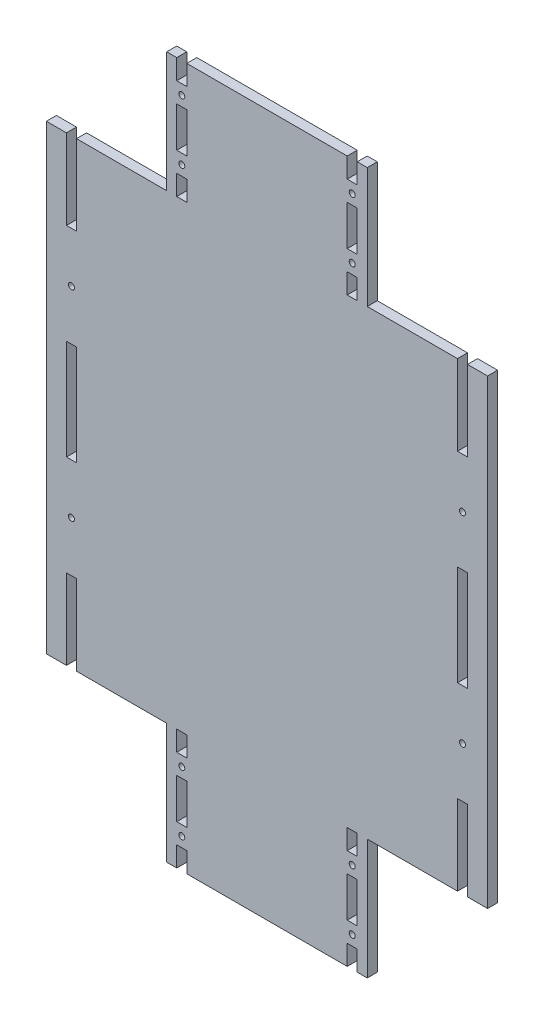
from build123d import *

# Parameters (mm, degrees)
SKETCH1_W           = 220
SKETCH1_H           = 350
BOSS_EXTRUDE1_DEPTH = 5
SKETCH2_W           = 60
SKETCH2_H           = 60
CUT_EXTRUDE2_DEPTH  = 5
SKETCH3_W           = 5
SKETCH3_H           = 10
SKETCH3_H_2         = 20
CUT_EXTRUDE3_DEPTH  = 5
SKETCH4_R           = 1.5
CUT_EXTRUDE4_DEPTH  = 5
SKETCH5_W           = 5
SKETCH5_H           = 40
SKETCH5_H_2         = 50
CUT_EXTRUDE5_DEPTH  = 5
SKETCH6_R           = 1.5
CUT_EXTRUDE6_DEPTH  = 5


with BuildPart() as part:
    # Sketch1 → Boss-Extrude1 (new body)
    with BuildSketch(Plane.XY):
        Rectangle(SKETCH1_W, SKETCH1_H)
    extrude(amount=BOSS_EXTRUDE1_DEPTH)

    # Sketch2 → Cut-Extrude2 (cut)
    with BuildSketch(Plane.XY.offset(5)):
        with Locations((-80, -145)):
            Rectangle(SKETCH2_W, SKETCH2_H)
        with Locations((80, -145)):
            Rectangle(SKETCH2_W, SKETCH2_H)
        with Locations((80, 145)):
            Rectangle(SKETCH2_W, SKETCH2_H)
        with Locations((-80, 145)):
            Rectangle(SKETCH2_W, SKETCH2_H)
    extrude(amount=-CUT_EXTRUDE2_DEPTH, mode=Mode.SUBTRACT)

    # Sketch3 → Cut-Extrude3 (cut)
    with BuildSketch(Plane.XY.offset(5)):
        with Locations((42.5, 170)):
            Rectangle(SKETCH3_W, SKETCH3_H)
        with Locations((42.5, 145)):
            Rectangle(SKETCH3_W, SKETCH3_H_2)
        with Locations((42.5, 120)):
            Rectangle(SKETCH3_W, SKETCH3_H)
        with Locations((-42.5, 170)):
            Rectangle(SKETCH3_W, SKETCH3_H)
        with Locations((-42.5, 145)):
            Rectangle(SKETCH3_W, SKETCH3_H_2)
        with Locations((-42.5, 120)):
            Rectangle(SKETCH3_W, SKETCH3_H)
        with Locations((42.5, -120)):
            Rectangle(SKETCH3_W, SKETCH3_H)
        with Locations((42.5, -145)):
            Rectangle(SKETCH3_W, SKETCH3_H_2)
        with Locations((42.5, -170)):
            Rectangle(SKETCH3_W, SKETCH3_H)
        with Locations((-42.5, -120)):
            Rectangle(SKETCH3_W, SKETCH3_H)
        with Locations((-42.5, -145)):
            Rectangle(SKETCH3_W, SKETCH3_H_2)
        with Locations((-42.5, -170)):
            Rectangle(SKETCH3_W, SKETCH3_H)
    extrude(amount=-CUT_EXTRUDE3_DEPTH, mode=Mode.SUBTRACT)

    # Sketch4 → Cut-Extrude4 (cut)
    with BuildSketch(Plane.XY.offset(5)):
        with Locations((-42.5, 160)):
            Circle(SKETCH4_R)
        with Locations(Location((42.5, 160, 0), (0, 0, 180))):
            Circle(SKETCH4_R)
        with Locations((-42.5, 130)):
            Circle(SKETCH4_R)
        with Locations((42.5, 130)):
            Circle(SKETCH4_R)
        with Locations((-42.5, -160)):
            Circle(SKETCH4_R)
        with Locations((-42.5, -130)):
            Circle(SKETCH4_R)
        with Locations((42.5, -130)):
            Circle(SKETCH4_R)
        with Locations((42.5, -160)):
            Circle(SKETCH4_R)
    extrude(amount=-CUT_EXTRUDE4_DEPTH, mode=Mode.SUBTRACT)

    # Sketch5 → Cut-Extrude5 (cut)
    with BuildSketch(Plane.XY.offset(5)):
        with Locations((-97.5, -95)):
            Rectangle(SKETCH5_W, SKETCH5_H)
        with Locations((-97.5, 0)):
            Rectangle(SKETCH5_W, SKETCH5_H_2)
        with Locations((-97.5, 95)):
            Rectangle(SKETCH5_W, SKETCH5_H)
        with Locations((97.5, 95)):
            Rectangle(SKETCH5_W, SKETCH5_H)
        with Locations((97.5, 0)):
            Rectangle(SKETCH5_W, SKETCH5_H_2)
        with Locations((97.5, -95)):
            Rectangle(SKETCH5_W, SKETCH5_H)
    extrude(amount=-CUT_EXTRUDE5_DEPTH, mode=Mode.SUBTRACT)

    # Sketch6 → Cut-Extrude6 (cut)
    with BuildSketch(Plane.XY.offset(5)):
        with Locations((-97.5, 50)):
            Circle(SKETCH6_R)
        with Locations((-97.5, -50)):
            Circle(SKETCH6_R)
        with Locations((97.5, 50)):
            Circle(SKETCH6_R)
        with Locations((97.5, -50)):
            Circle(SKETCH6_R)
    extrude(amount=-CUT_EXTRUDE6_DEPTH, mode=Mode.SUBTRACT)


solid = part.part
